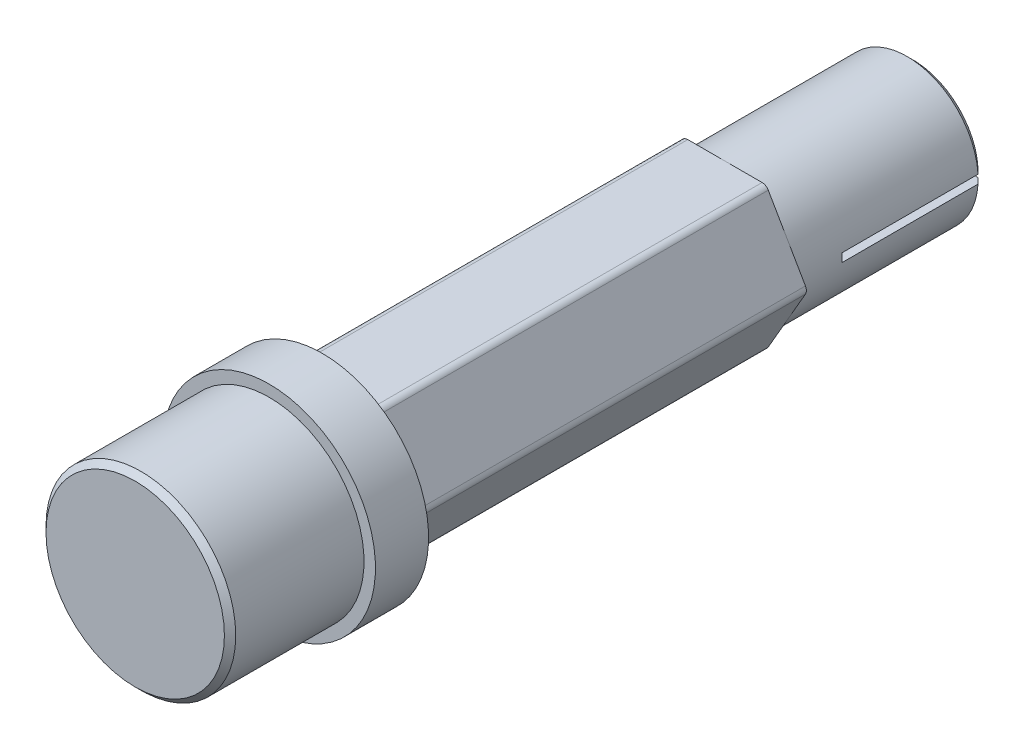
from build123d import *

# Parameters (mm, degrees)
SKETCH2_OUTSIDE_W  = 35.99
SKETCH2_OUTSIDE_H  = 35.99
CUT_EXTRUDE1_DEPTH = 36.07435
FILLET1_R          = 0.635
CUT_EXTRUDE2_START = -12.7
CUT_EXTRUDE2_DEPTH = 12.7
CHAMFER1_SIZE      = 0.508


with BuildPart() as part:
    # Sketch1 → Revolve1 (revolve)
    with BuildSketch(Plane(origin=(0, 0, 0), x_dir=(0, 0, -1), z_dir=(1, 0, 0)), mode=Mode.PRIVATE) as revolve1_sk:
        Polygon((0, 0), (0, 8.5), (12, 8.5), (12, 9.525), (16.7625, 9.525), (16.7625, 7.62), (40.08605, 7.62), (52.83685, 7.62), (52.83685, 6.35), (69.67705, 6.35), (69.67705, 3.175), (54.43705, 3.175), (52.529317535, 0), align=None)
    revolve(revolve1_sk.sketch.rotate(Axis((0, 0, 0), (0, 0, 1)), 90), axis=Axis((0, 0, 0), (0, 0, 1)))

    # Sketch2 outside → Cut-Extrude1 (cut)
    with BuildSketch(Plane(origin=(0, 0, -16.7625), x_dir=(-1, 0, 0), z_dir=(0, 0, -1))):
        Rectangle(SKETCH2_OUTSIDE_W, SKETCH2_OUTSIDE_H)
        Polygon((3.696970073, 6.40334), (-3.696970073, 6.40334), (-7.393940145, 0), (-3.696970073, -6.40334), (3.696970073, -6.40334), (7.393940145, 0), align=None, mode=Mode.SUBTRACT)
    extrude(amount=CUT_EXTRUDE1_DEPTH, mode=Mode.SUBTRACT)

    # Fillet1
    fillet1_edges = [part.edges().sort_by_distance(p)[0] for p in [
        (-7.393940145, 0, -34.799675),
        (-3.696970073, -6.40334, -34.799675),
        (3.696970073, -6.40334, -34.799675),
        (7.393940145, 0, -34.799675),
        (3.696970073, 6.40334, -34.799675),
        (-3.696970073, 6.40334, -34.799675),
    ]]
    fillet(fillet1_edges, radius=FILLET1_R)

    # Sketch3 → Cut-Extrude2 (cut)
    with BuildSketch(Plane(origin=(0, 0, -69.67705), x_dir=(-1, 0, 0), z_dir=(0, 0, -1)).offset(CUT_EXTRUDE2_START)):
        with BuildLine():
            Line((-8.998734144, 0.381), (-3.152057106, 0.381))
            ThreePointArc((-3.152057106, 0.381), (0, 3.175), (3.152057106, 0.381))
            Line((3.152057106, 0.381), (8.998734144, 0.381))
            Line((8.998734144, 0.381), (8.998734144, -0.381))
            Line((8.998734144, -0.381), (3.152057106, -0.381))
            ThreePointArc((3.152057106, -0.381), (0, -3.175), (-3.152057106, -0.381))
            Line((-3.152057106, -0.381), (-8.998734144, -0.381))
            Line((-8.998734144, -0.381), (-8.998734144, 0.381))
        make_face()
    extrude(amount=CUT_EXTRUDE2_DEPTH, mode=Mode.SUBTRACT)

    # Chamfer1
    chamfer1_edges = [part.edges().sort_by_distance(p)[0] for p in [
        (0, 6.35, -69.67705),
        (8.5, 0, 0),
        (0, -6.35, -69.67705),
    ]]
    chamfer(chamfer1_edges, length=CHAMFER1_SIZE)


solid = part.part
